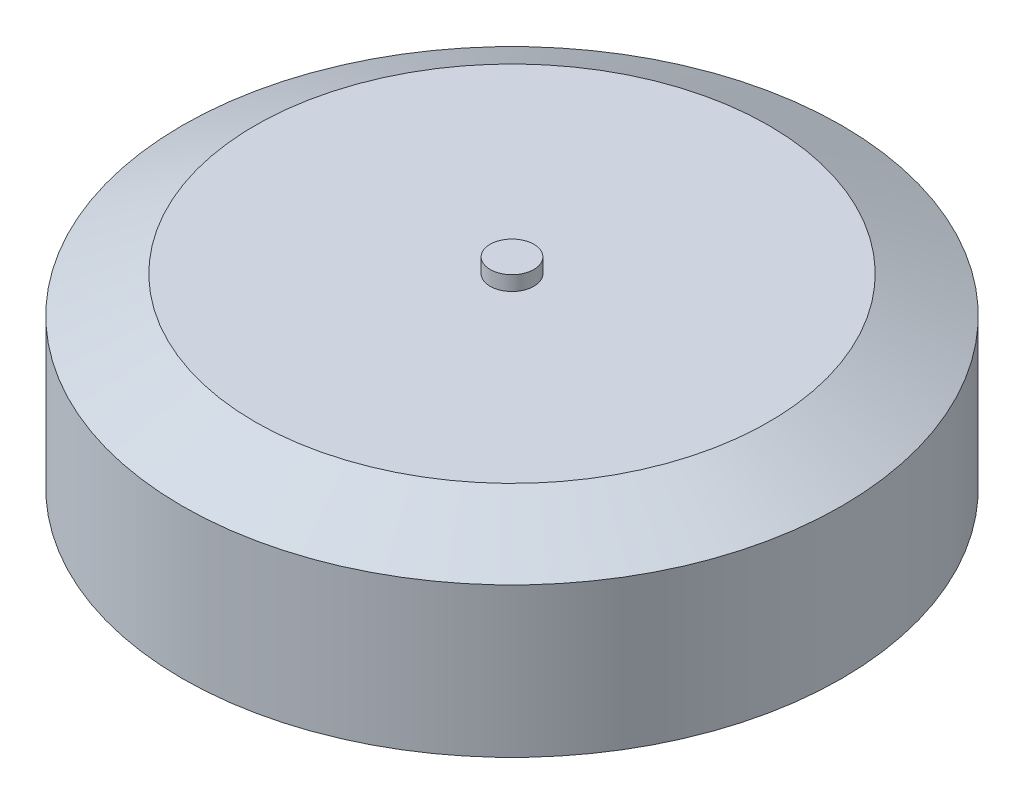
from build123d import *

# Parameters (mm, degrees)
ESQUISSE2_R        = 3
BOSS_EXTRU_1_DEPTH = 2


with BuildPart() as part:
    # Esquisse1 → Révolution1 (revolve)
    with BuildSketch(Plane.XY, mode=Mode.PRIVATE) as r_volution1_sk:
        Polygon((0, 15.25), (-35.25, 15.25), (-45.25, 10.25), (-45.25, -10.25), (-35.25, -15.25), (0, -15.25), align=None)
    revolve(r_volution1_sk.sketch.rotate(Axis((0, -78.381633957, 0), (0, 1, 0)), 270), axis=Axis((0, -78.381633957, 0), (0, 1, 0)))

    # Esquisse2 → Boss.-Extru.1 (add)
    with BuildSketch(Plane(origin=(0, 15.25, 0), x_dir=(1, 0, 0), z_dir=(0, 1, 0))):
        with Locations(Location((0, 0, 0), (0, 0, 90))):
            Circle(ESQUISSE2_R)
    extrude(amount=BOSS_EXTRU_1_DEPTH)


solid = part.part
